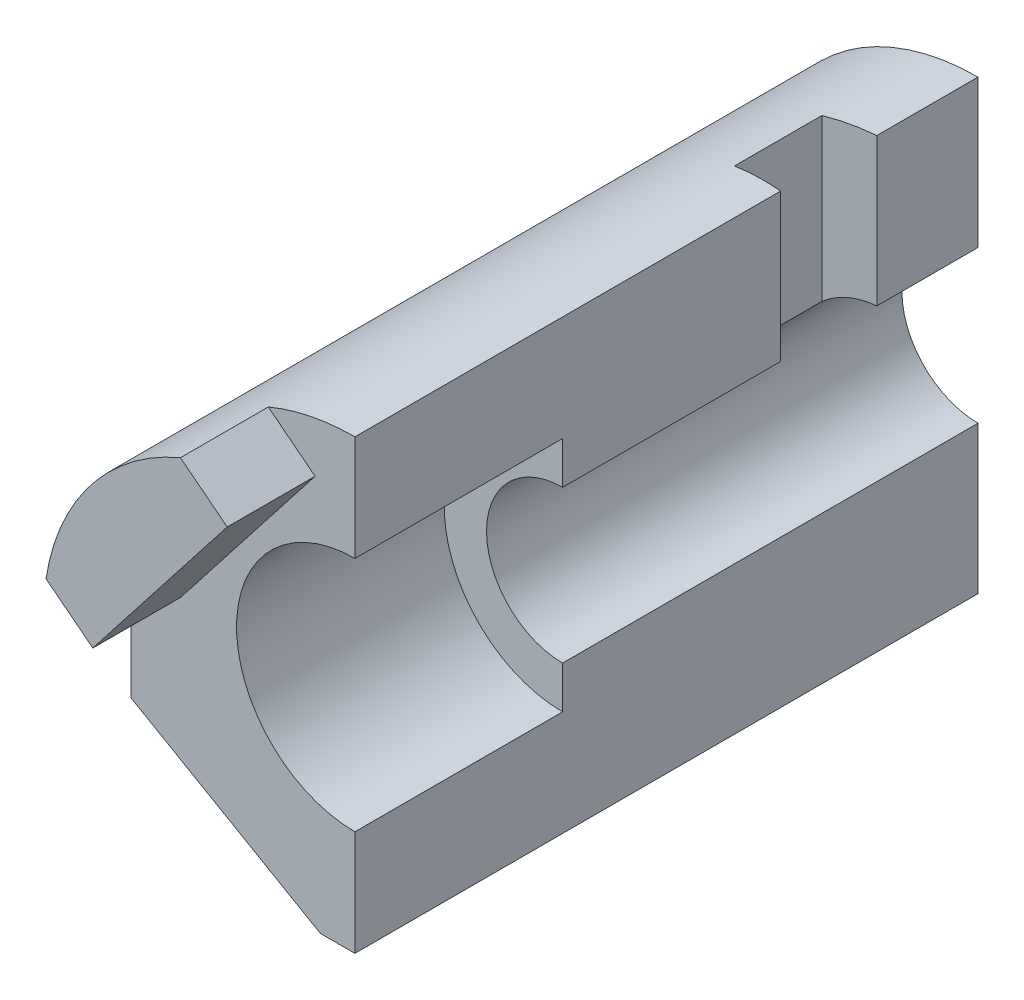
from build123d import *

# Parameters (mm, degrees)
BOSS_EXTRUDE2_DEPTH     = 234
SKETCH3_R               = 44.45
CUT_EXTRUDE1_DEPTH      = 78
BOSS_EXTRUDE3_DEPTH     = 33
CUT_EXTRUDE3_REACH      = 336.868
CUT_EXTRUDE3_END_RADIUS = 28.575


with BuildPart() as part:
    # Sketch1 → Boss-Extrude2 (new body)
    with BuildSketch(Plane.XY):
        with BuildLine():
            Line((28.35361426, 84), (28.35361426, 40.991869112))
            Line((28.35361426, 40.991869112), (99.35361426, 0))
            Line((99.35361426, 0), (112.35361426, 0))
            Line((112.35361426, 0), (112.35361426, 55.425))
            ThreePointArc((112.35361426, 55.425), (83.77861426, 84), (112.35361426, 112.575))
            Line((112.35361426, 112.575), (112.35361426, 168))
            ThreePointArc((112.35361426, 168), (52.95664464, 143.39696962), (28.35361426, 84))
        make_face()
    extrude(amount=BOSS_EXTRUDE2_DEPTH)

    # Sketch3 → Cut-Extrude1 (cut)
    with BuildSketch(Plane.XY.offset(234)):
        with Locations((112.35361426, 84)):
            Circle(SKETCH3_R)
    extrude(amount=-CUT_EXTRUDE1_DEPTH, mode=Mode.SUBTRACT)

    # Sketch4 → Boss-Extrude3 (add)
    with BuildSketch(Plane.XY.offset(234)):
        with BuildLine():
            Line((46.922945338, 83.090294344), (97.407186315, 147.707176139))
            Line((97.407186315, 147.707176139), (79.823205858, 161.445287327))
            ThreePointArc((79.823205858, 161.445287327), (46.160710957, 135.715563927), (29.338964881, 96.828405531))
            Line((29.338964881, 96.828405531), (46.922945338, 83.090294344))
        make_face()
    extrude(amount=BOSS_EXTRUDE3_DEPTH)

    # Cut-Extrude3: up to this cylinder (the profile starts outside it)
    cut_extrude3_end = Plane(origin=(112.35361426, 84, 56.053764), z_dir=(0, 0, -1)) * Cylinder(CUT_EXTRUDE3_END_RADIUS, 731.886, mode=Mode.PRIVATE)
    # Sketch5 → Cut-Extrude3 (cut, up to the surface)
    with BuildSketch(Plane(origin=(0, 168, 0), x_dir=(1, 0, 0), z_dir=(0, 1, 0)), mode=Mode.PRIVATE) as cut_extrude3_sk1:
        Polygon((112.35361426, -38), (112.35361426, -74.107528994), (93.35361426, -72.445244387), (93.35361426, -39.662284607), align=None)
    cut_extrude3_tool1 = extrude(cut_extrude3_sk1.sketch, amount=-CUT_EXTRUDE3_REACH, mode=Mode.PRIVATE) - cut_extrude3_end
    add(cut_extrude3_tool1.solids().sort_by_distance((103.006434, 168, 56.053764))[0], mode=Mode.SUBTRACT)


solid = part.part
